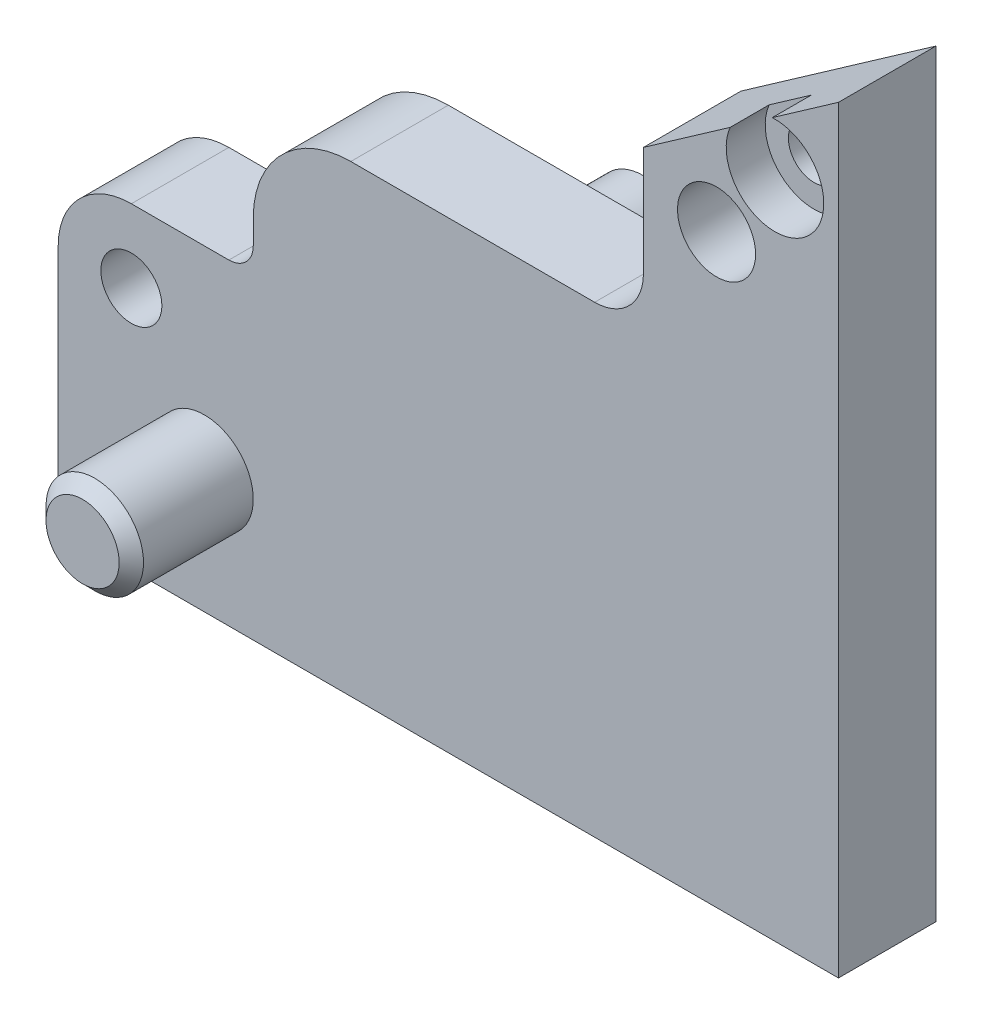
from build123d import *

# Parameters (mm, degrees)
SKETCH1_W                       = 32
SKETCH1_H                       = 31.101660306
BOSS_EXTRUDE1_DEPTH             = 4
SKETCH2_W                       = 8
SKETCH2_H                       = 18.101660306
CUT_EXTRUDE1_DEPTH              = 45.803049827
SKETCH3_W                       = 16
SKETCH3_H                       = 12.101660306
CUT_EXTRUDE2_DEPTH              = 45.803049827
DRAFT1_ANGLE                    = -35.000000002
SKETCH4_W                       = 2
SKETCH4_H                       = 5
SKETCH5_W                       = 2
SKETCH5_H                       = 5
F_3_2_3_2_DIAMETER_HOLE1_D      = 3.2
F_3_2_3_2_DIAMETER_HOLE1_DEPTH  = 9
F_2_5_2_5_DIAMETER_HOLE1_D      = 2.5
F_2_5_2_5_DIAMETER_HOLE1_DEPTH  = 9
M4X0_7_TAPPED_HOLE1_D           = 2.1
M4X0_7_TAPPED_HOLE1_DEPTH       = 9
M4X0_7_TAPPED_HOLE1_CBORE_D     = 4
M4X0_7_TAPPED_HOLE1_CBORE_DEPTH = 1.6
F_2_5_2_5_DIAMETER_HOLE2_D      = 2.5
F_2_5_2_5_DIAMETER_HOLE2_DEPTH  = 7.5
F_2_5_2_5_DIAMETER_HOLE2_TIP    = 0.751075774
CHAMFER1_SIZE                   = 0.5
FILLET1_R                       = 1
FILLET2_R                       = 2
FILLET3_R                       = 3
FILLET4_R                       = 4


with BuildPart() as part:
    # Sketch1 → Boss-Extrude1 (new body)
    with BuildSketch(Plane(origin=(0, 0, 0), x_dir=(-1, 0, 0), z_dir=(0, 0, -1))):
        with Locations((-16, 15.550830153)):
            Rectangle(SKETCH1_W, SKETCH1_H)
    extrude(amount=-BOSS_EXTRUDE1_DEPTH)

    # Sketch2 → Cut-Extrude1 (cut, through all)
    with BuildSketch(Plane.XY.offset(4)):
        with Locations((4, 22.050830153)):
            Rectangle(SKETCH2_W, SKETCH2_H)
    extrude(amount=-CUT_EXTRUDE1_DEPTH, mode=Mode.SUBTRACT)

    # Sketch3 → Cut-Extrude2 (cut, through all)
    with BuildSketch(Plane.XY.offset(4)):
        with Locations((16, 25.050830153)):
            Rectangle(SKETCH3_W, SKETCH3_H)
    extrude(amount=-CUT_EXTRUDE2_DEPTH, mode=Mode.SUBTRACT)

    # Draft1
    draft1_faces = [part.faces().sort_by_distance(p)[0] for p in [
        (28, 31.101660306, 2),
    ]]
    draft(draft1_faces, Plane(origin=(32, 31.101660306, 4), x_dir=(0, 0, 1), z_dir=(1, 0, 0)), DRAFT1_ANGLE)

    # Sketch4 → Revolve1 (revolve)
    with BuildSketch(Plane.XZ.offset(-5), mode=Mode.PRIVATE) as revolve1_sk:
        with Locations((7, 6.5)):
            Rectangle(SKETCH4_W, SKETCH4_H)
    revolve(revolve1_sk.sketch.rotate(Axis((6, 5, 9), (0, 0, -1)), 180), axis=Axis((6, 5, 9), (0, 0, -1)))

    # Sketch5 → Revolve2 (revolve)
    with BuildSketch(Plane(origin=(0, 14, 0), x_dir=(1, 0, 0), z_dir=(0, 1, 0))):
        with Locations((16.5, 2.5)):
            Rectangle(SKETCH5_W, SKETCH5_H)
    revolve(axis=Axis((15.5, 14, -5), (0, 0, 1)))

    # Ø3.2 (3.2) Diameter Hole1
    with Locations(Plane.XY.offset(4)):
        with Locations((27, 24)):
            Hole(F_3_2_3_2_DIAMETER_HOLE1_D / 2, depth=F_3_2_3_2_DIAMETER_HOLE1_DEPTH)

    # Ø2.5 (2.5) Diameter Hole1
    with Locations(Plane(origin=(0, 0, 0), x_dir=(-1, 0, 0), z_dir=(0, 0, -1))):
        with Locations((-3, 10)):
            Hole(F_2_5_2_5_DIAMETER_HOLE1_D / 2, depth=F_2_5_2_5_DIAMETER_HOLE1_DEPTH)

    # M4x0.7 Tapped Hole1
    with Locations(Plane.XY.offset(4)):
        with Locations((29.395995182, 27.202999702)):
            CounterBoreHole(M4X0_7_TAPPED_HOLE1_D / 2, M4X0_7_TAPPED_HOLE1_CBORE_D / 2, M4X0_7_TAPPED_HOLE1_CBORE_DEPTH, depth=M4X0_7_TAPPED_HOLE1_DEPTH)

    # Ø2.5 (2.5) Diameter Hole2
    with Locations(Plane(origin=(0, 0, 0), x_dir=(-1, 0, 0), z_dir=(0, -1, 0))):
        with Locations((-10, -2), (-19.5, -2), (-29, -2)):
            Hole(F_2_5_2_5_DIAMETER_HOLE2_D / 2, depth=F_2_5_2_5_DIAMETER_HOLE2_DEPTH)
            with Locations((0, 0, -(F_2_5_2_5_DIAMETER_HOLE2_DEPTH + F_2_5_2_5_DIAMETER_HOLE2_TIP / 2))):  # 118° drill point
                Cone(0, F_2_5_2_5_DIAMETER_HOLE2_D / 2, F_2_5_2_5_DIAMETER_HOLE2_TIP, mode=Mode.SUBTRACT)

    # Chamfer1
    chamfer1_edges = [part.edges().sort_by_distance(p)[0] for p in [
        (8, 5, 9),
        (13.5, 14, -5),
    ]]
    chamfer(chamfer1_edges, length=CHAMFER1_SIZE)

    # Fillet1
    fillet1_edges = [part.edges().sort_by_distance(p)[0] for p in [
        (8, 13, 2),
    ]]
    fillet(fillet1_edges, radius=FILLET1_R)

    # Fillet2
    fillet2_edges = [part.edges().sort_by_distance(p)[0] for p in [
        (24, 19, 2),
    ]]
    fillet(fillet2_edges, radius=FILLET2_R)

    # Fillet3
    fillet3_edges = [part.edges().sort_by_distance(p)[0] for p in [
        (0, 13, 2),
    ]]
    fillet(fillet3_edges, radius=FILLET3_R)

    # Fillet4
    fillet4_edges = [part.edges().sort_by_distance(p)[0] for p in [
        (8, 19, 2),
    ]]
    fillet(fillet4_edges, radius=FILLET4_R)


solid = part.part
